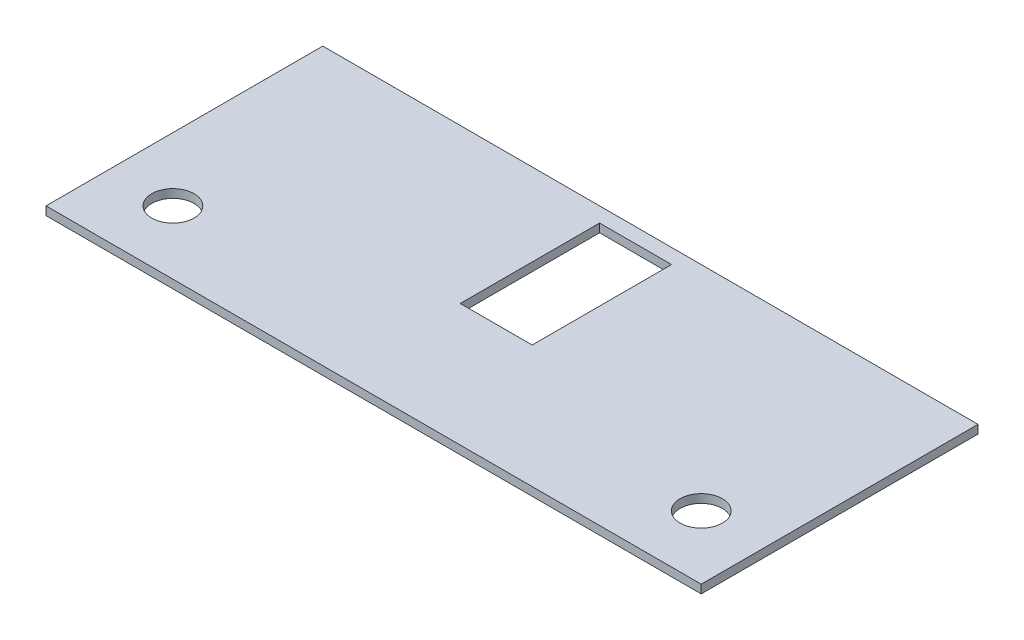
from build123d import *

# Parameters (mm, degrees)
SKETCH_1_W          = 154.889723794
SKETCH_1_H          = 65.431275614
SKETCH_1_W_2        = 17
SKETCH_1_H_2        = 32.940924084
EXTRUDE_1_DEPTH     = 2
SKETCH_2_R          = 5
CUT_EXTRUDE_2_DEPTH = 90.609556274


with BuildPart() as part:
    # Эскиз1 → Вытянуть1 (new body)
    with BuildSketch(Plane(origin=(0, 0, 0), x_dir=(1, 0, 0), z_dir=(0, 1, 0))):
        with Locations((0, -12.319525582)):
            Rectangle(SKETCH_1_W, SKETCH_1_H)
        with Locations((0, 0.417277171)):
            Rectangle(SKETCH_1_W_2, SKETCH_1_H_2, mode=Mode.SUBTRACT)
    extrude(amount=EXTRUDE_1_DEPTH)

    # Эскиз2 → Вытянуть2 (cut, through all)
    with BuildSketch(Plane(origin=(0, 2, 0), x_dir=(1, 0, 0), z_dir=(0, 1, 0))):
        with Locations(Location((-62.444861897, -30.035163389, 0), (0, 0, 270))):
            Circle(SKETCH_2_R)
        with Locations(Location((62.444861897, -30.035163389, 0), (0, 0, 90))):
            Circle(SKETCH_2_R)
    extrude(amount=-CUT_EXTRUDE_2_DEPTH, mode=Mode.SUBTRACT)


solid = part.part
